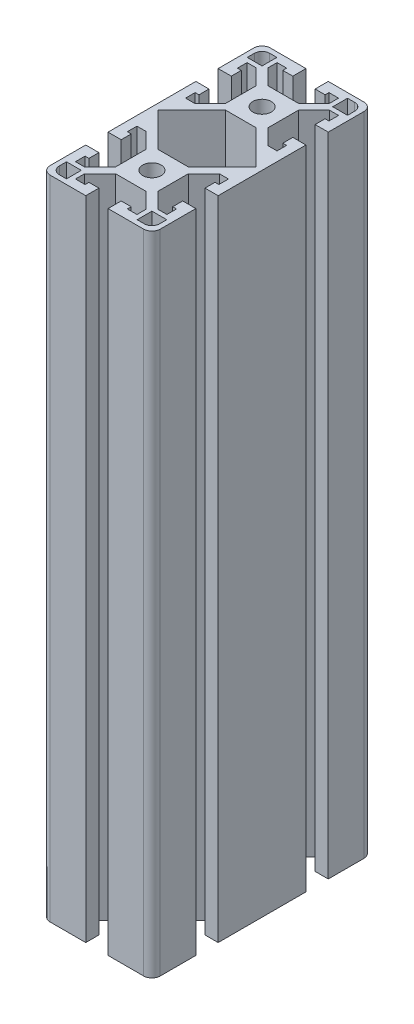
from build123d import *

# Parameters (mm, degrees)
SKETCH2_R                            = 3.35
F_40_SERIES_TS40_80LM_650037_1_DEPTH = 235
M8X1_25_TAPPED_HOLE1_D               = 6.8
M8X1_25_TAPPED_HOLE1_DEPTH           = 25
M8X1_25_TAPPED_HOLE1_TIP             = 2.042926105


with BuildPart() as part:
    # Sketch2 → 40 series TS40-80LM-650037(1) (new body)
    with BuildSketch(Plane(origin=(0, 0, 0), x_dir=(-1, 0, 0), z_dir=(0, 1, 0))):
        with BuildLine():
            Line((0, -27.681), (-5.525738531, -27.681))
            Line((-5.525738531, -27.681), (-11.176, -33.331261469))
            Line((-11.176, -33.331261469), (-11.176, -36.6218))
            Line((-11.176, -36.6218), (-7.6835, -36.6218))
            Line((-7.6835, -36.6218), (-7.6835, -35.2248))
            Line((-7.6835, -35.2248), (-4.0488, -35.2248))
            Line((-4.0488, -35.2248), (-4.0488, -40))
            Line((-4.0488, -40), (-17, -40))
            ThreePointArc((-17, -40), (-19.121320344, -39.121320344), (-20, -37))
            Line((-20, -37), (-20, -24.0488))
            Line((-20, -24.0488), (-15.2248, -24.0488))
            Line((-15.2248, -24.0488), (-15.2248, -27.6835))
            Line((-15.2248, -27.6835), (-16.6218, -27.6835))
            Line((-16.6218, -27.6835), (-16.6218, -31.176))
            Line((-16.6218, -31.176), (-13.331261469, -31.176))
            Line((-13.331261469, -31.176), (-7.681, -25.525738531))
            Line((-7.681, -25.525738531), (-7.681, -20))
            Line((-7.681, -20), (-7.681, -14.474261469))
            Line((-7.681, -14.474261469), (-13.331261469, -8.824))
            Line((-13.331261469, -8.824), (-16.6218, -8.824))
            Line((-16.6218, -8.824), (-16.6218, -12.3165))
            Line((-16.6218, -12.3165), (-15.2248, -12.3165))
            Line((-15.2248, -12.3165), (-15.2248, -15.9512))
            Line((-15.2248, -15.9512), (-20, -15.9512))
            Line((-20, -15.9512), (-20, 15.9512))
            Line((-20, 15.9512), (-15.2248, 15.9512))
            Line((-15.2248, 15.9512), (-15.2248, 12.3165))
            Line((-15.2248, 12.3165), (-16.6218, 12.3165))
            Line((-16.6218, 12.3165), (-16.6218, 8.824))
            Line((-16.6218, 8.824), (-13.331261469, 8.824))
            Line((-13.331261469, 8.824), (-7.681, 14.474261469))
            Line((-7.681, 14.474261469), (-7.681, 25.525738531))
            Line((-7.681, 25.525738531), (-13.331261469, 31.176))
            Line((-13.331261469, 31.176), (-16.6218, 31.176))
            Line((-16.6218, 31.176), (-16.6218, 27.6835))
            Line((-16.6218, 27.6835), (-15.2248, 27.6835))
            Line((-15.2248, 27.6835), (-15.2248, 24.0488))
            Line((-15.2248, 24.0488), (-20, 24.0488))
            Line((-20, 24.0488), (-20, 37))
            ThreePointArc((-20, 37), (-19.121320344, 39.121320344), (-17, 40))
            Line((-17, 40), (-4.0488, 40))
            Line((-4.0488, 40), (-4.0488, 35.2248))
            Line((-4.0488, 35.2248), (-7.6835, 35.2248))
            Line((-7.6835, 35.2248), (-7.6835, 36.6218))
            Line((-7.6835, 36.6218), (-11.176, 36.6218))
            Line((-11.176, 36.6218), (-11.176, 33.331261469))
            Line((-11.176, 33.331261469), (-5.525738531, 27.681))
            Line((-5.525738531, 27.681), (0, 27.681))
            Line((0, 27.681), (5.525738531, 27.681))
            Line((5.525738531, 27.681), (11.176, 33.331261469))
            Line((11.176, 33.331261469), (11.176, 36.6218))
            Line((11.176, 36.6218), (7.6835, 36.6218))
            Line((7.6835, 36.6218), (7.6835, 35.2248))
            Line((7.6835, 35.2248), (4.0488, 35.2248))
            Line((4.0488, 35.2248), (4.0488, 40))
            Line((4.0488, 40), (17, 40))
            ThreePointArc((17, 40), (19.121320344, 39.121320344), (20, 37))
            Line((20, 37), (20, 24.0488))
            Line((20, 24.0488), (15.2248, 24.0488))
            Line((15.2248, 24.0488), (15.2248, 27.6835))
            Line((15.2248, 27.6835), (16.6218, 27.6835))
            Line((16.6218, 27.6835), (16.6218, 31.176))
            Line((16.6218, 31.176), (13.331261469, 31.176))
            Line((13.331261469, 31.176), (7.681, 25.525738531))
            Line((7.681, 25.525738531), (7.681, 20))
            Line((7.681, 20), (7.681, 14.474261469))
            Line((7.681, 14.474261469), (13.331261469, 8.824))
            Line((13.331261469, 8.824), (16.6218, 8.824))
            Line((16.6218, 8.824), (16.6218, 12.3165))
            Line((16.6218, 12.3165), (15.2248, 12.3165))
            Line((15.2248, 12.3165), (15.2248, 15.9512))
            Line((15.2248, 15.9512), (20, 15.9512))
            Line((20, 15.9512), (20, -15.9512))
            Line((20, -15.9512), (15.2248, -15.9512))
            Line((15.2248, -15.9512), (15.2248, -12.3165))
            Line((15.2248, -12.3165), (16.6218, -12.3165))
            Line((16.6218, -12.3165), (16.6218, -8.824))
            Line((16.6218, -8.824), (13.331261469, -8.824))
            Line((13.331261469, -8.824), (7.681, -14.474261469))
            Line((7.681, -14.474261469), (7.681, -20))
            Line((7.681, -20), (7.681, -25.525738531))
            Line((7.681, -25.525738531), (13.331261469, -31.176))
            Line((13.331261469, -31.176), (16.6218, -31.176))
            Line((16.6218, -31.176), (16.6218, -27.6835))
            Line((16.6218, -27.6835), (15.2248, -27.6835))
            Line((15.2248, -27.6835), (15.2248, -24.0488))
            Line((15.2248, -24.0488), (20, -24.0488))
            Line((20, -24.0488), (20, -37))
            ThreePointArc((20, -37), (19.121320344, -39.121320344), (17, -40))
            Line((17, -40), (4.0488, -40))
            Line((4.0488, -40), (4.0488, -35.2248))
            Line((4.0488, -35.2248), (7.6835, -35.2248))
            Line((7.6835, -35.2248), (7.6835, -36.6218))
            Line((7.6835, -36.6218), (11.176, -36.6218))
            Line((11.176, -36.6218), (11.176, -33.331261469))
            Line((11.176, -33.331261469), (5.525738531, -27.681))
            Line((5.525738531, -27.681), (0, -27.681))
        make_face()
        with Locations((0, -20)):
            Circle(SKETCH2_R, mode=Mode.SUBTRACT)
        with Locations((0, 20)):
            Circle(SKETCH2_R, mode=Mode.SUBTRACT)
        Polygon((-5.525738531, 12.319), (-17.844738531, 0), (-5.525738531, -12.319), (0, -12.319), (5.525738531, -12.319), (17.844738531, 0), (5.525738531, 12.319), (0, 12.319), align=None, mode=Mode.SUBTRACT)
        with BuildLine():
            Line((12.8372, 38.222), (12.8372, 32.8372))
            Line((12.8372, 32.8372), (18.222, 32.8372))
            Line((18.222, 32.8372), (18.222, 35.428))
            ThreePointArc((18.222, 35.428), (17.403656347, 37.403656347), (15.428, 38.222))
            Line((15.428, 38.222), (12.8372, 38.222))
        make_face(mode=Mode.SUBTRACT)
        with BuildLine():
            Line((12.8372, -32.8372), (18.222, -32.8372))
            Line((18.222, -32.8372), (18.222, -35.428))
            ThreePointArc((18.222, -35.428), (17.403656347, -37.403656347), (15.428, -38.222))
            Line((15.428, -38.222), (12.8372, -38.222))
            Line((12.8372, -38.222), (12.8372, -32.8372))
        make_face(mode=Mode.SUBTRACT)
        with BuildLine():
            Line((-12.8372, -38.222), (-12.8372, -32.8372))
            Line((-12.8372, -32.8372), (-18.222, -32.8372))
            Line((-18.222, -32.8372), (-18.222, -35.428))
            ThreePointArc((-18.222, -35.428), (-17.403656347, -37.403656347), (-15.428, -38.222))
            Line((-15.428, -38.222), (-12.8372, -38.222))
        make_face(mode=Mode.SUBTRACT)
        with BuildLine():
            Line((-18.222, 35.428), (-18.222, 32.8372))
            Line((-18.222, 32.8372), (-12.8372, 32.8372))
            Line((-12.8372, 32.8372), (-12.8372, 38.222))
            Line((-12.8372, 38.222), (-15.428, 38.222))
            ThreePointArc((-15.428, 38.222), (-17.403656347, 37.403656347), (-18.222, 35.428))
        make_face(mode=Mode.SUBTRACT)
    extrude(amount=F_40_SERIES_TS40_80LM_650037_1_DEPTH)

    # M8x1.25 Tapped Hole1
    with Locations(Plane(origin=(0, 0, 0), x_dir=(-1, 0, 0), z_dir=(0, -1, 0))):
        with Locations((0, -20), (0, 20)):
            Hole(M8X1_25_TAPPED_HOLE1_D / 2, depth=M8X1_25_TAPPED_HOLE1_DEPTH)
            with Locations((0, 0, -(M8X1_25_TAPPED_HOLE1_DEPTH + M8X1_25_TAPPED_HOLE1_TIP / 2))):  # 118° drill point
                Cone(0, M8X1_25_TAPPED_HOLE1_D / 2, M8X1_25_TAPPED_HOLE1_TIP, mode=Mode.SUBTRACT)


solid = part.part
